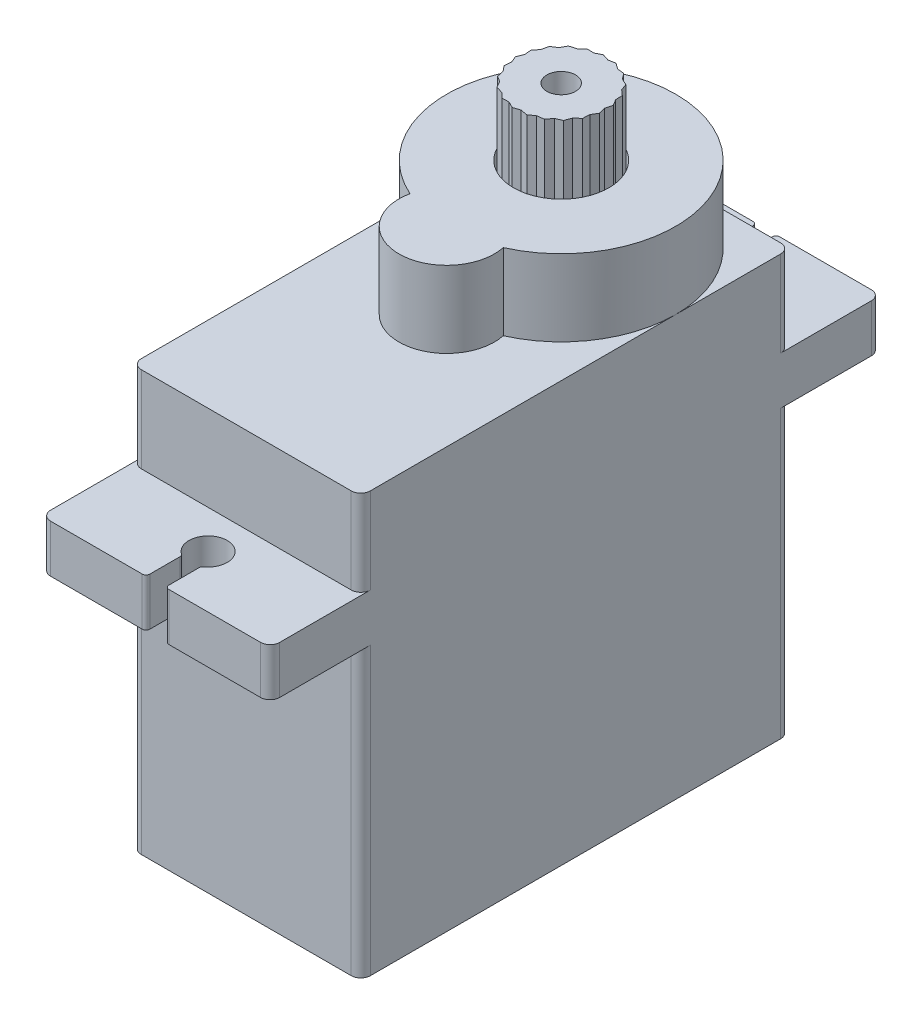
from build123d import *

# Parameters (mm, degrees)
Y_KSEKLIK_EKSTR_ZYON1_DEPTH  = 1
Y_KSEKLIK_EKSTR_ZYON2_DEPTH  = 5
IZIM3_W                      = 4
IZIM3_H                      = 1
KES_EKSTR_ZYON1_DEPTH        = 1
RADYUS1_R                    = 0.1
Y_KSEKLIK_EKSTR_ZYON4_DEPTH  = 9
Y_KSEKLIK_EKSTR_ZYON5_DEPTH  = 2.5
Y_KSEKLIK_EKSTR_ZYON6_DEPTH  = 3.5
Y_KSEKLIK_EKSTR_ZYON7_DEPTH  = 1
KES_EKSTR_ZYON2_DEPTH        = 1
Y_KSEKLIK_EKSTR_ZYON8_START  = 3
Y_KSEKLIK_EKSTR_ZYON8_DEPTH  = 3
RADYUS2_R                    = 0.5
Y_KSEKLIK_EKSTR_ZYON9_START  = 1
Y_KSEKLIK_EKSTR_ZYON9_DEPTH  = 1
IZIM11_R                     = 2.5
KES_EKSTR_ZYON3_DEPTH        = 10
IZIM15_R                     = 0.25
Y_KSEKLIK_EKSTR_ZYON12_DEPTH = 11
IZIM19_R                     = 2.4
Y_KSEKLIK_EKSTR_ZYON17_DEPTH = 5
IZIM20_R                     = 4.75
Y_KSEKLIK_EKSTR_ZYON18_DEPTH = 3
IZIM21_R                     = 0.75
KES_EKSTR_ZYON5_DEPTH        = 10
IZIM22_R                     = 0.5
Y_KSEKLIK_EKSTR_ZYON19_DEPTH = 5
IZIM23_R                     = 4
Y_KSEKLIK_EKSTR_ZYON20_DEPTH = 2
IZIM24_R                     = 0.75
Y_KSEKLIK_EKSTR_ZYON21_DEPTH = 7
IZIM25_R                     = 3.5
Y_KSEKLIK_EKSTR_ZYON22_DEPTH = 1
IZIM26_R                     = 4.5
Y_KSEKLIK_EKSTR_ZYON23_DEPTH = 1
KES_EKSTR_ZYON7_DEPTH        = 30
Y_KSEKLIK_EKSTR_ZYON33_DEPTH = 1
Y_KSEKLIK_EKSTR_ZYON34_DEPTH = 14
IZIM37_W                     = 8
IZIM37_H                     = 6
Y_KSEKLIK_EKSTR_ZYON36_DEPTH = 1
IZIM39_W                     = 4
IZIM39_H                     = 1
Y_KSEKLIK_EKSTR_ZYON37_DEPTH = 0.1
IZIM40_R                     = 0.4
Y_KSEKLIK_EKSTR_ZYON38_DEPTH = 2
CUT_EXTRUDE1_DEPTH           = 5
CIRPATTERN1_COUNT            = 21
SKETCH2_W                    = 12
SKETCH2_H                    = 12
CUT_EXTRUDE2_DEPTH           = 0.5


with BuildPart() as part:
    # Çizim1 → Yükseklik-Ekstrüzyon1 (new body)
    with BuildSketch(Plane(origin=(0, 0, 0), x_dir=(1, 0, 0), z_dir=(0, 1, 0))):
        with BuildLine():
            Line((-5.5, 11.25), (5.5, 11.25))
            ThreePointArc((5.5, 11.25), (5.853553391, 11.103553391), (6, 10.75))
            Line((6, 10.75), (6, -10.75))
            ThreePointArc((6, -10.75), (5.853553391, -11.103553391), (5.5, -11.25))
            Line((5.5, -11.25), (-5.5, -11.25))
            ThreePointArc((-5.5, -11.25), (-5.853553391, -11.103553391), (-6, -10.75))
            Line((-6, -10.75), (-6, 10.75))
            ThreePointArc((-6, 10.75), (-5.853553391, 11.103553391), (-5.5, 11.25))
        make_face()
    extrude(amount=Y_KSEKLIK_EKSTR_ZYON1_DEPTH)

    # Çizim2 → Yükseklik-Ekstrüzyon2 (add)
    with BuildSketch(Plane(origin=(0, 1, 0), x_dir=(1, 0, 0), z_dir=(0, 1, 0))):
        with BuildLine():
            Line((-5.5, 11.25), (5.5, 11.25))
            ThreePointArc((5.5, 11.25), (5.853553391, 11.103553391), (6, 10.75))
            Line((6, 10.75), (6, -10.75))
            ThreePointArc((6, -10.75), (5.853553391, -11.103553391), (5.5, -11.25))
            Line((5.5, -11.25), (-5.5, -11.25))
            ThreePointArc((-5.5, -11.25), (-5.853553391, -11.103553391), (-6, -10.75))
            Line((-6, -10.75), (-6, 10.75))
            ThreePointArc((-6, 10.75), (-5.853553391, 11.103553391), (-5.5, 11.25))
        make_face()
        with BuildLine():
            Line((-5, 9.25), (-5, -9.25))
            ThreePointArc((-5, -9.25), (-4.292893219, -9.542893219), (-4, -10.25))
            Line((-4, -10.25), (4, -10.25))
            ThreePointArc((4, -10.25), (4.292893219, -9.542893219), (5, -9.25))
            Line((5, -9.25), (5, 9.25))
            ThreePointArc((5, 9.25), (4.292893219, 9.542893219), (4, 10.25))
            Line((4, 10.25), (-4, 10.25))
            ThreePointArc((-4, 10.25), (-4.292893219, 9.542893219), (-5, 9.25))
        make_face(mode=Mode.SUBTRACT)
    extrude(amount=Y_KSEKLIK_EKSTR_ZYON2_DEPTH)

    # Çizim3 → Kes-Ekstrüzyon1 (cut)
    with BuildSketch(Plane(origin=(0, 6, 0), x_dir=(1, 0, 0), z_dir=(0, 1, 0))):
        with Locations((0, -10.75)):
            Rectangle(IZIM3_W, IZIM3_H)
    extrude(amount=-KES_EKSTR_ZYON1_DEPTH, mode=Mode.SUBTRACT)

    # Radyus1
    radyus1_edges = [part.edges().sort_by_distance(p)[0] for p in [
        (2, 5, 10.75),
        (-2, 5, 10.75),
    ]]
    fillet(radyus1_edges, radius=RADYUS1_R)

    # Çizim4 → Yükseklik-Ekstrüzyon4 (add)
    with BuildSketch(Plane(origin=(0, 6, 0), x_dir=(1, 0, 0), z_dir=(0, 1, 0))):
        with BuildLine():
            Line((5.5, 11.25), (-5.5, 11.25))
            ThreePointArc((-5.5, 11.25), (-5.853553391, 11.103553391), (-6, 10.75))
            Line((-6, 10.75), (-6, -10.75))
            ThreePointArc((-6, -10.75), (-5.853553391, -11.103553391), (-5.5, -11.25))
            Line((-5.5, -11.25), (5.5, -11.25))
            ThreePointArc((5.5, -11.25), (5.853553391, -11.103553391), (6, -10.75))
            Line((6, -10.75), (6, 10.75))
            ThreePointArc((6, 10.75), (5.853553391, 11.103553391), (5.5, 11.25))
        make_face()
        with BuildLine():
            ThreePointArc((-5, 9.25), (-4.292893219, 9.542893219), (-4, 10.25))
            Line((-4, 10.25), (4, 10.25))
            ThreePointArc((4, 10.25), (4.292893219, 9.542893219), (5, 9.25))
            Line((5, 9.25), (5, -9.25))
            ThreePointArc((5, -9.25), (4.292893219, -9.542893219), (4, -10.25))
            Line((4, -10.25), (-4, -10.25))
            ThreePointArc((-4, -10.25), (-4.292893219, -9.542893219), (-5, -9.25))
            Line((-5, -9.25), (-5, 9.25))
        make_face(mode=Mode.SUBTRACT)
    extrude(amount=Y_KSEKLIK_EKSTR_ZYON4_DEPTH)

    # Çizim6 → Yükseklik-Ekstrüzyon5 (add)
    with BuildSketch(Plane(origin=(0, 15, 0), x_dir=(1, 0, 0), z_dir=(0, 1, 0))):
        with BuildLine():
            Line((-5.5, 16), (-0.7, 16))
            ThreePointArc((-0.7, 16), (-0.558578644, 15.941421356), (-0.5, 15.8))
            Line((-0.5, 15.8), (-0.5, 14.224679434))
            ThreePointArc((-0.5, 14.224679434), (-0.522048696, 14.133392342), (-0.583333333, 14.062232862))
            ThreePointArc((-0.583333333, 14.062232862), (0, 12.25), (0.583333333, 14.062232862))
            ThreePointArc((0.583333333, 14.062232862), (0.522048696, 14.133392342), (0.5, 14.224679434))
            Line((0.5, 14.224679434), (0.5, 15.8))
            ThreePointArc((0.5, 15.8), (0.558578644, 15.941421356), (0.7, 16))
            Line((0.7, 16), (5.5, 16))
            ThreePointArc((5.5, 16), (5.853553391, 15.853553391), (6, 15.5))
            Line((6, 15.5), (6, -15.5))
            ThreePointArc((6, -15.5), (5.853553391, -15.853553391), (5.5, -16))
            Line((5.5, -16), (0.7, -16))
            ThreePointArc((0.7, -16), (0.558578644, -15.941421356), (0.5, -15.8))
            Line((0.5, -15.8), (0.5, -14.224679434))
            ThreePointArc((0.5, -14.224679434), (0.522048696, -14.133392342), (0.583333333, -14.062232862))
            ThreePointArc((0.583333333, -14.062232862), (0, -12.25), (-0.583333333, -14.062232862))
            ThreePointArc((-0.583333333, -14.062232862), (-0.522048696, -14.133392342), (-0.5, -14.224679434))
            Line((-0.5, -14.224679434), (-0.5, -15.8))
            ThreePointArc((-0.5, -15.8), (-0.558578644, -15.941421356), (-0.7, -16))
            Line((-0.7, -16), (-5.5, -16))
            ThreePointArc((-5.5, -16), (-5.853553391, -15.853553391), (-6, -15.5))
            Line((-6, -15.5), (-6, 15.5))
            ThreePointArc((-6, 15.5), (-5.853553391, 15.853553391), (-5.5, 16))
        make_face()
        with BuildLine():
            Line((-4, 10.25), (4, 10.25))
            ThreePointArc((4, 10.25), (4.292893219, 9.542893219), (5, 9.25))
            Line((5, 9.25), (5, -9.25))
            ThreePointArc((5, -9.25), (4.292893219, -9.542893219), (4, -10.25))
            Line((4, -10.25), (-4, -10.25))
            ThreePointArc((-4, -10.25), (-4.292893219, -9.542893219), (-5, -9.25))
            Line((-5, -9.25), (-5, 9.25))
            ThreePointArc((-5, 9.25), (-4.292893219, 9.542893219), (-4, 10.25))
        make_face(mode=Mode.SUBTRACT)
    extrude(amount=Y_KSEKLIK_EKSTR_ZYON5_DEPTH)

    # Çizim7 → Yükseklik-Ekstrüzyon6 (add)
    with BuildSketch(Plane(origin=(0, 17.5, 0), x_dir=(1, 0, 0), z_dir=(0, 1, 0))):
        with BuildLine():
            Line((5.5, 11.25), (-5.5, 11.25))
            ThreePointArc((-5.5, 11.25), (-5.853553391, 11.103553391), (-6, 10.75))
            Line((-6, 10.75), (-6, -10.75))
            ThreePointArc((-6, -10.75), (-5.853553391, -11.103553391), (-5.5, -11.25))
            Line((-5.5, -11.25), (5.5, -11.25))
            ThreePointArc((5.5, -11.25), (5.853553391, -11.103553391), (6, -10.75))
            Line((6, -10.75), (6, 10.75))
            ThreePointArc((6, 10.75), (5.853553391, 11.103553391), (5.5, 11.25))
        make_face()
        with BuildLine():
            Line((-5, -9.25), (-5, 9.25))
            ThreePointArc((-5, 9.25), (-4.292893219, 9.542893219), (-4, 10.25))
            Line((-4, 10.25), (4, 10.25))
            ThreePointArc((4, 10.25), (4.292893219, 9.542893219), (5, 9.25))
            Line((5, 9.25), (5, -9.25))
            ThreePointArc((5, -9.25), (4.292893219, -9.542893219), (4, -10.25))
            Line((4, -10.25), (-4, -10.25))
            ThreePointArc((-4, -10.25), (-4.292893219, -9.542893219), (-5, -9.25))
        make_face(mode=Mode.SUBTRACT)
    extrude(amount=Y_KSEKLIK_EKSTR_ZYON6_DEPTH)

    # Çizim8 → Yükseklik-Ekstrüzyon7 (add)
    with BuildSketch(Plane(origin=(0, 21, 0), x_dir=(1, 0, 0), z_dir=(0, 1, 0))):
        with BuildLine():
            Line((-5.5, 11.25), (5.5, 11.25))
            ThreePointArc((5.5, 11.25), (5.853553391, 11.103553391), (6, 10.75))
            Line((6, 10.75), (6, -10.75))
            ThreePointArc((6, -10.75), (5.853553391, -11.103553391), (5.5, -11.25))
            Line((5.5, -11.25), (-5.5, -11.25))
            ThreePointArc((-5.5, -11.25), (-5.853553391, -11.103553391), (-6, -10.75))
            Line((-6, -10.75), (-6, 10.75))
            ThreePointArc((-6, 10.75), (-5.853553391, 11.103553391), (-5.5, 11.25))
        make_face()
    extrude(amount=Y_KSEKLIK_EKSTR_ZYON7_DEPTH)

    # Çizim9 → Kes-Ekstrüzyon2 (cut)
    with BuildSketch(Plane(origin=(0, 22, 0), x_dir=(1, 0, 0), z_dir=(0, 1, 0))):
        with BuildLine():
            ThreePointArc((1.015291078, 0.354166667), (0, 10.25), (-1.015291078, 0.354166667))
            ThreePointArc((-1.015291078, 0.354166667), (0, -2.25), (1.015291078, 0.354166667))
        make_face()
    extrude(amount=-KES_EKSTR_ZYON2_DEPTH, mode=Mode.SUBTRACT)

    # Çizim9<3> → Yükseklik-Ekstrüzyon8 (add)
    with BuildSketch(Plane(origin=(0, 22, 0), x_dir=(1, 0, 0), z_dir=(0, 1, 0)).offset(Y_KSEKLIK_EKSTR_ZYON8_START)):
        with BuildLine():
            ThreePointArc((2.445144707, -0.229166667), (0, 11.25), (-2.445144707, -0.229166667))
            ThreePointArc((-2.445144707, -0.229166667), (0, -3.25), (2.445144707, -0.229166667))
        make_face()
        with BuildLine():
            ThreePointArc((1.015291078, 0.354166667), (0, 10.25), (-1.015291078, 0.354166667))
            ThreePointArc((-1.015291078, 0.354166667), (0, -2.25), (1.015291078, 0.354166667))
        make_face(mode=Mode.SUBTRACT)
    extrude(amount=-Y_KSEKLIK_EKSTR_ZYON8_DEPTH)

    # Radyus2
    radyus2_edges = [part.edges().sort_by_distance(p)[0] for p in [
        (-1.015291078, 23, -0.354166667),
        (1.015291078, 23, -0.354166667),
    ]]
    fillet(radyus2_edges, radius=RADYUS2_R)

    # Çizim10 → Yükseklik-Ekstrüzyon9 (add)
    with BuildSketch(Plane(origin=(0, 25, 0), x_dir=(1, 0, 0), z_dir=(0, 1, 0)).offset(Y_KSEKLIK_EKSTR_ZYON9_START)):
        with BuildLine():
            ThreePointArc((2.445144707, -0.229166667), (0, 11.25), (-2.445144707, -0.229166667))
            ThreePointArc((-2.445144707, -0.229166667), (0, -3.25), (2.445144707, -0.229166667))
        make_face()
    extrude(amount=-Y_KSEKLIK_EKSTR_ZYON9_DEPTH)

    # Çizim11 → Kes-Ekstrüzyon3 (cut)
    with BuildSketch(Plane(origin=(0, 26, 0), x_dir=(1, 0, 0), z_dir=(0, 1, 0))):
        with Locations(Location((0, 5.25, 0), (0, 0, 270))):
            Circle(IZIM11_R)
    extrude(amount=-KES_EKSTR_ZYON3_DEPTH, mode=Mode.SUBTRACT)

    # Çizim15 → Yükseklik-Ekstrüzyon12 (add)
    with BuildSketch(Plane(origin=(0, 26, 0), x_dir=(1, 0, 0), z_dir=(0, 1, 0))):
        with Locations(Location((0, -0.75, 0), (0, 0, 270))):
            Circle(IZIM15_R)
    extrude(amount=-Y_KSEKLIK_EKSTR_ZYON12_DEPTH)



with BuildPart() as body_2:
    # Çizim19 → Yükseklik-Ekstrüzyon17 (new body)
    with BuildSketch(Plane(origin=(0, 30, 0), x_dir=(1, 0, 0), z_dir=(0, 1, 0))):
        with Locations(Location((0, 5.25, 0), (0, 0, 270))):
            Circle(IZIM19_R)
    extrude(amount=-Y_KSEKLIK_EKSTR_ZYON17_DEPTH)


with BuildPart() as part_1:
    add(part.part)

    add(body_2.part)  # Yükseklik-Ekstrüzyon18 merges body 2
    # Çizim20 → Yükseklik-Ekstrüzyon18 (add)
    with BuildSketch(Plane.XZ.offset(-25)):
        with Locations(Location((0, -5.25, 0), (0, 0, 90))):
            Circle(IZIM20_R)
    extrude(amount=Y_KSEKLIK_EKSTR_ZYON18_DEPTH)

    # Çizim21 → Kes-Ekstrüzyon5 (cut)
    with BuildSketch(Plane(origin=(0, 30, 0), x_dir=(1, 0, 0), z_dir=(0, 1, 0))):
        with Locations(Location((0, 5.25, 0), (0, 0, 270))):
            Circle(IZIM21_R)
    extrude(amount=-KES_EKSTR_ZYON5_DEPTH, mode=Mode.SUBTRACT)

    # Çizim22 → Yükseklik-Ekstrüzyon19 (add)
    with BuildSketch(Plane(origin=(0, 25.5, 0), x_dir=(1, 0, 0), z_dir=(0, 1, 0))):
        with Locations(Location((0, -0.75, 0), (0, 0, 270))):
            Circle(IZIM22_R)
    extrude(amount=-Y_KSEKLIK_EKSTR_ZYON19_DEPTH)

    # Çizim23 → Yükseklik-Ekstrüzyon20 (add)
    with BuildSketch(Plane.XZ.offset(-20.5)):
        with Locations(Location((0, 0.75, 0), (0, 0, 270))):
            Circle(IZIM23_R)
    extrude(amount=Y_KSEKLIK_EKSTR_ZYON20_DEPTH)

    # Çizim26 → Yükseklik-Ekstrüzyon23 (add)
    with BuildSketch(Plane(origin=(0, 17.5, 0), x_dir=(-1, 0, 0), z_dir=(0, -1, 0))):
        with Locations(Location((0, -0.75, 0), (0, 0, 90))):
            Circle(IZIM26_R)
    extrude(amount=Y_KSEKLIK_EKSTR_ZYON23_DEPTH)

    # Çizim32 → Kes-Ekstrüzyon7 (cut)
    with BuildSketch(Plane(origin=(0, 0, 10.25), x_dir=(-1, 0, 0), z_dir=(0, 0, -1))):
        with BuildLine():
            Line((2, 6), (-2, 6))
            Line((-2, 6), (-2, 5.1))
            ThreePointArc((-2, 5.1), (-1.970710678, 5.029289322), (-1.9, 5))
            Line((-1.9, 5), (1.9, 5))
            ThreePointArc((1.9, 5), (1.970710678, 5.029289322), (2, 5.1))
            Line((2, 5.1), (2, 6))
        make_face()
    extrude(amount=KES_EKSTR_ZYON7_DEPTH, mode=Mode.SUBTRACT)

    # Çizim33 → Yükseklik-Ekstrüzyon33 (add)
    with BuildSketch(Plane.XY.offset(11.25)):
        with BuildLine():
            Line((-2, 6), (2, 6))
            Line((2, 6), (2, 5.1))
            ThreePointArc((2, 5.1), (1.970710678, 5.029289322), (1.9, 5))
            Line((1.9, 5), (-1.9, 5))
            ThreePointArc((-1.9, 5), (-1.970710678, 5.029289322), (-2, 5.1))
            Line((-2, 5.1), (-2, 6))
        make_face()
    extrude(amount=-Y_KSEKLIK_EKSTR_ZYON33_DEPTH)

    # Çizim34 → Yükseklik-Ekstrüzyon34 (add)
    with BuildSketch(Plane(origin=(0, 1, 0), x_dir=(1, 0, 0), z_dir=(0, 1, 0))):
        with BuildLine():
            Line((-3, -3.25), (3, -3.25))
            ThreePointArc((3, -3.25), (3.707106781, -3.542893219), (4, -4.25))
            Line((4, -4.25), (4, -8.25))
            ThreePointArc((4, -8.25), (3.707106781, -8.957106781), (3, -9.25))
            Line((3, -9.25), (-3, -9.25))
            ThreePointArc((-3, -9.25), (-3.707106781, -8.957106781), (-4, -8.25))
            Line((-4, -8.25), (-4, -4.25))
            ThreePointArc((-4, -4.25), (-3.707106781, -3.542893219), (-3, -3.25))
        make_face()
    extrude(amount=Y_KSEKLIK_EKSTR_ZYON34_DEPTH)

    # Çizim37 → Yükseklik-Ekstrüzyon36 (add)
    with BuildSketch(Plane(origin=(0, 1, 0), x_dir=(-1, 0, 0), z_dir=(0, -1, 0))):
        with Locations((0, -6.25)):
            Rectangle(IZIM37_W, IZIM37_H)
    extrude(amount=-Y_KSEKLIK_EKSTR_ZYON36_DEPTH)

    # Çizim39 → Yükseklik-Ekstrüzyon37 (add)
    with BuildSketch(Plane(origin=(0, 0, -10.75), x_dir=(-1, 0, 0), z_dir=(0, 0, -1))):
        with Locations((0, 5.514566781)):
            Rectangle(IZIM39_W, IZIM39_H)
    extrude(amount=Y_KSEKLIK_EKSTR_ZYON37_DEPTH)

    # Çizim40 → Yükseklik-Ekstrüzyon38 (add)
    with BuildSketch(Plane(origin=(0, 0, -10.85), x_dir=(-1, 0, 0), z_dir=(0, 0, -1))):
        with Locations((0, 5.55)):
            Circle(IZIM40_R)
        with Locations((1, 5.55)):
            Circle(IZIM40_R)
        with Locations((-1, 5.55)):
            Circle(IZIM40_R)
    extrude(amount=Y_KSEKLIK_EKSTR_ZYON38_DEPTH)

    # Sketch1 → Cut-Extrude1 (cut)
    with BuildSketch(Plane(origin=(0, 30, 0), x_dir=(1, 0, 0), z_dir=(0, 1, 0))):
        Polygon((2.372082418, 5.615), (2.28, 5.25), (2.372082418, 4.885), (2.472082418, 4.885), (2.472082418, 5.615), align=None)
    cut_extrude1 = extrude(amount=-CUT_EXTRUDE1_DEPTH, mode=Mode.SUBTRACT)

    # CirPattern1: Cut-Extrude1 ×21 about axis
    cirpattern1_axis = Axis((0, 0, -5.25), (0, 1, 0))
    for i in range(1, CIRPATTERN1_COUNT):
        add(cut_extrude1.rotate(cirpattern1_axis, i * 360 / CIRPATTERN1_COUNT), mode=Mode.SUBTRACT)

    # Sketch2 → Cut-Extrude2 (cut)
    with BuildSketch(Plane(origin=(0, 30, 0), x_dir=(1, 0, 0), z_dir=(0, 1, 0))):
        with Locations((0, 5.25)):
            Rectangle(SKETCH2_W, SKETCH2_H)
    extrude(amount=-CUT_EXTRUDE2_DEPTH, mode=Mode.SUBTRACT)


with BuildPart() as body_2_2:
    # Çizim24 → Yükseklik-Ekstrüzyon21 (new body)
    with BuildSketch(Plane.XZ.offset(-22)):
        with Locations(Location((0, -5.25, 0), (0, 0, 270))):
            Circle(IZIM24_R)
    extrude(amount=Y_KSEKLIK_EKSTR_ZYON21_DEPTH)

    # Çizim25 → Yükseklik-Ekstrüzyon22 (add)
    with BuildSketch(Plane(origin=(0, 19, 0), x_dir=(-1, 0, 0), z_dir=(0, -1, 0))):
        with Locations(Location((0, 5.25, 0), (0, 0, 90))):
            Circle(IZIM25_R)
    extrude(amount=Y_KSEKLIK_EKSTR_ZYON22_DEPTH)


solid = Compound([part_1.part, body_2_2.part])
